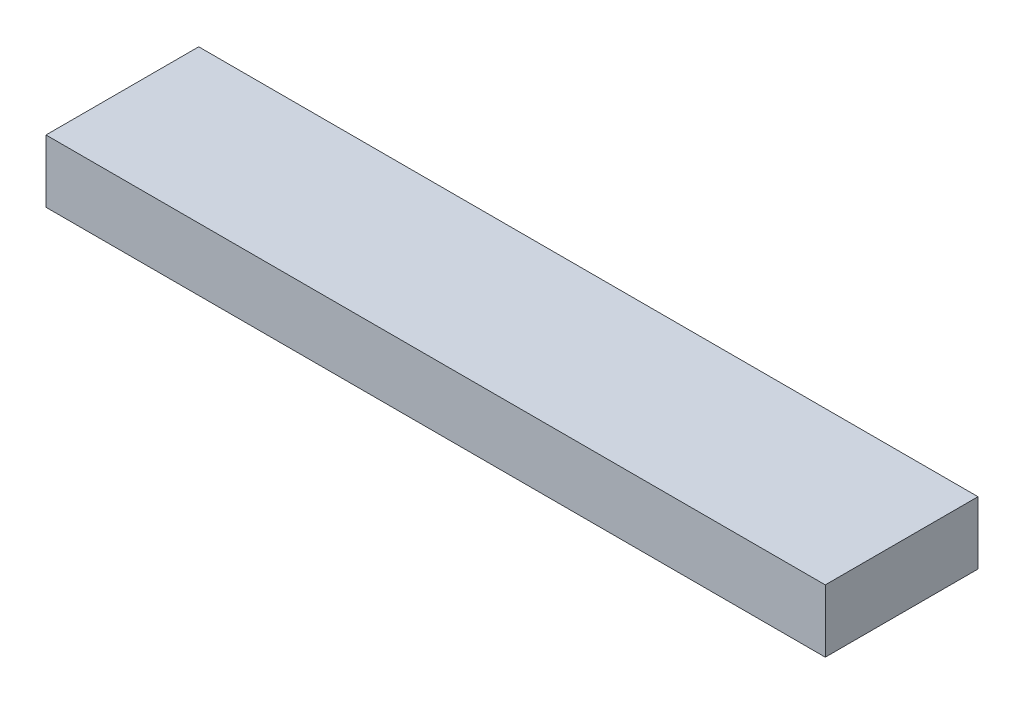
from build123d import *

# Parameters (mm, degrees)
SKETCH_1_W          = 39.8
SKETCH_1_H          = 7.8
EXTRUDE_1_DEPTH     = 3.2
SKETCH_2_R          = 2.5
CUT_EXTRUDE_1_DEPTH = 1.8


with BuildPart() as part:
    # Эскиз1 → Бобышка-Вытянуть1 (new body)
    with BuildSketch(Plane(origin=(0, 0, 0), x_dir=(1, 0, 0), z_dir=(0, 1, 0))):
        Rectangle(SKETCH_1_W, SKETCH_1_H)
    extrude(amount=EXTRUDE_1_DEPTH)

    # Эскиз2 → Вырез-Вытянуть1 (cut)
    with BuildSketch(Plane.XZ):
        with Locations(Location((16, 0, 0), (0, 0, 270))):
            Circle(SKETCH_2_R)
        with Locations(Location((8.126, 0, 0), (0, 0, 270))):
            Circle(SKETCH_2_R)
        with Locations(Location((0.252, 0, 0), (0, 0, 270))):
            Circle(SKETCH_2_R)
        with Locations(Location((-7.622, 0, 0), (0, 0, 270))):
            Circle(SKETCH_2_R)
        with Locations(Location((-15.496, 0, 0), (0, 0, 270))):
            Circle(SKETCH_2_R)
    extrude(amount=-CUT_EXTRUDE_1_DEPTH, mode=Mode.SUBTRACT)


solid = part.part
